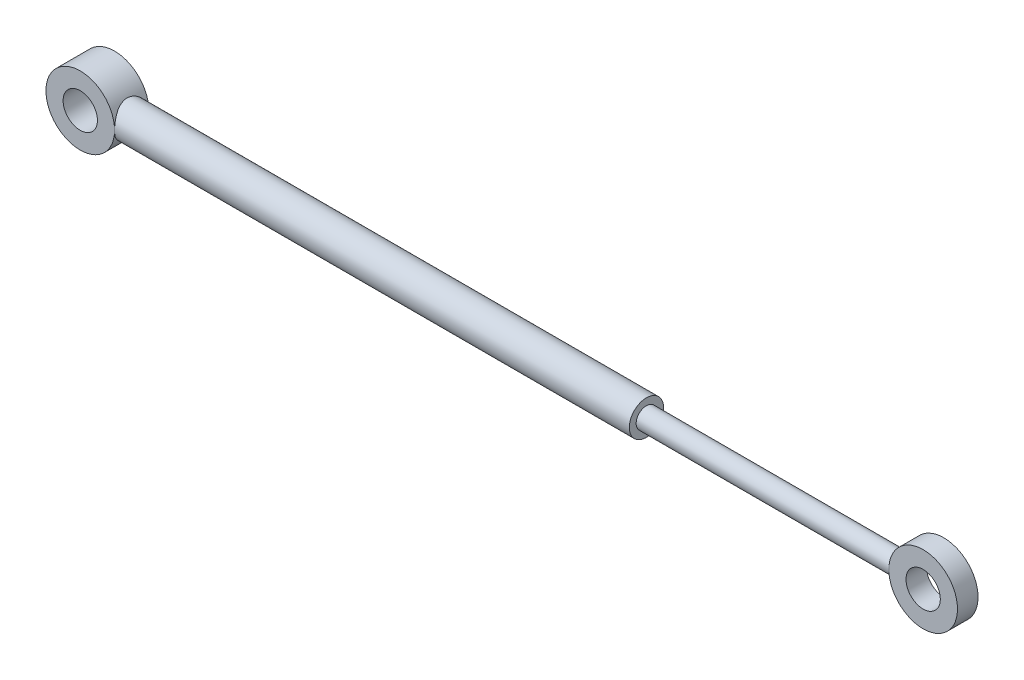
from build123d import *

# Parameters (mm, degrees)
SKETCH_1_R               = 10
SKETCH_1_R_2             = 5
EXTRUDE_1_DEPTH          = 10
EXTRUDE_START            = 7
SKETCH_2_R               = 3
EXTRUDE_1_2_DEPTH        = 230
SKETCH_3_R               = 10
SKETCH_3_R_2             = 5
EXTRUDE_2_DEPTH          = 10
CUT_EXTRUDE_2_DEPTH      = 16
CUT_EXTRUDE_2_DEPTH_BACK = 16
SKETCH_5_W               = 25.612754073
SKETCH_5_H               = 5.27381734
SKETCH_5_W_2             = 26.516733628
SKETCH_5_H_2             = 5.299141178
EXTRUDE_START_2          = 5
SKETCH_6_R               = 5
SKETCH_6_R_2             = 3
EXTRUDE_3_DEPTH          = 155


with BuildPart() as part:
    # 草图1 → Extrude 1 (new body)
    with BuildSketch(Plane.XY):
        Circle(SKETCH_1_R)
        Circle(SKETCH_1_R_2, mode=Mode.SUBTRACT)
    extrude(amount=EXTRUDE_1_DEPTH)

    # 草图2 → Extrude 1 2 (add)
    with BuildSketch(Plane(origin=(0, 0, 0), x_dir=(0, 0, -1), z_dir=(1, 0, 0)).offset(EXTRUDE_START)):
        with Locations((-5, 0)):
            Circle(SKETCH_2_R)
    extrude(amount=EXTRUDE_1_2_DEPTH)


with BuildPart() as body_2:
    # 草图3 → 拉伸-薄壁2 (new body)
    with BuildSketch(Plane.XY):
        with Locations((243.643659116, 0)):
            Circle(SKETCH_3_R)
        with Locations((243.643659116, 0)):
            Circle(SKETCH_3_R_2, mode=Mode.SUBTRACT)
    extrude(amount=EXTRUDE_2_DEPTH)

    # 草图5 → 切除-拉伸2 (cut, two sides: drawn at the far end of the back side and taken through both)
    with BuildSketch(Plane(origin=(0, 0, 0), x_dir=(1, 0, 0), z_dir=(0, 1, 0)).offset(-CUT_EXTRUDE_2_DEPTH_BACK)):
        with Locations((246.038279089, 0.63690867)):
            Rectangle(SKETCH_5_W, SKETCH_5_H)
        with Locations((246.490268866, -10.649570589)):
            Rectangle(SKETCH_5_W_2, SKETCH_5_H_2)
    extrude(amount=CUT_EXTRUDE_2_DEPTH + CUT_EXTRUDE_2_DEPTH_BACK, mode=Mode.SUBTRACT)


with BuildPart() as body_3:
    # 草图6 → 拉伸-薄壁3 (new body)
    with BuildSketch(Plane(origin=(0, 0, 0), x_dir=(0, 0, -1), z_dir=(1, 0, 0)).offset(EXTRUDE_START_2)):
        with Locations((-5, 0)):
            Circle(SKETCH_6_R)
        with Locations((-5, 0)):
            Circle(SKETCH_6_R_2, mode=Mode.SUBTRACT)
    extrude(amount=EXTRUDE_3_DEPTH)


solid = Compound([part.part, body_2.part, body_3.part])
